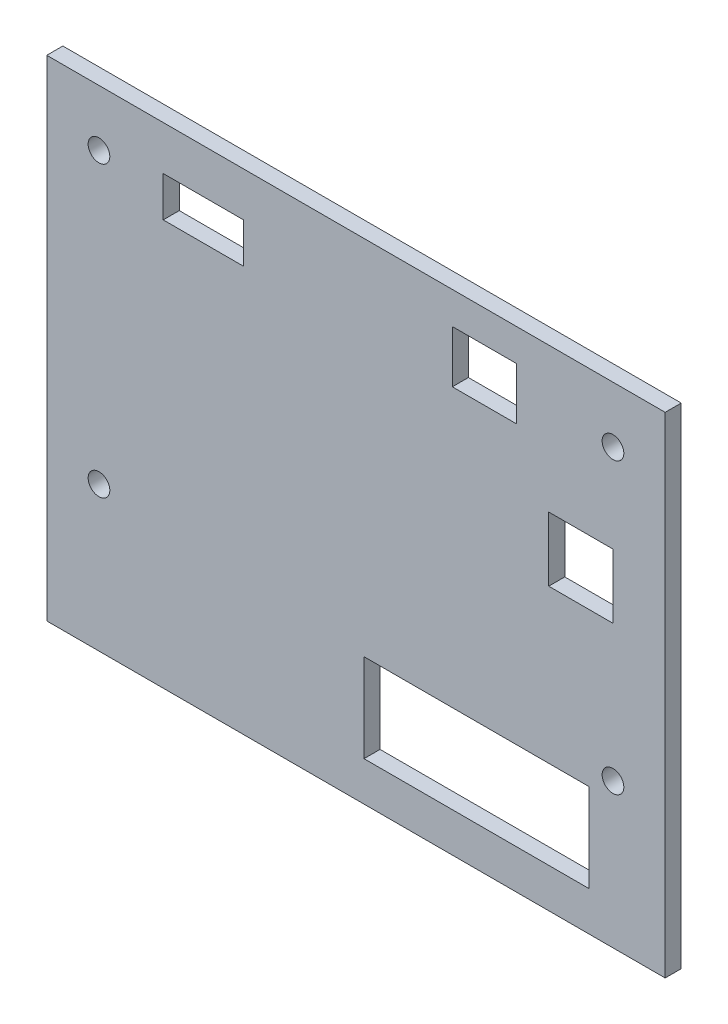
from build123d import *

# Parameters (mm, degrees)
SKETCH_1_W          = 77
SKETCH_1_H          = 61
EXTRUDE_1_DEPTH     = 2
SKETCH_2_W          = 28
SKETCH_2_H          = 11
CUT_EXTRUDE_1_DEPTH = 99.254770877
SKETCH_3_W          = 10
SKETCH_3_H          = 5
SKETCH_3_W_2        = 8
SKETCH_3_H_2        = 6.5
SKETCH_3_H_3        = 8
CUT_EXTRUDE_2_DEPTH = 99.254770877
SKETCH_4_R          = 1.35
CUT_EXTRUDE_3_DEPTH = 99.254770877


with BuildPart() as part:
    # 草图1 → 凸台-拉伸1 (new body)
    with BuildSketch(Plane.XY):
        with Locations((38.5, 30.5)):
            Rectangle(SKETCH_1_W, SKETCH_1_H)
    extrude(amount=EXTRUDE_1_DEPTH)

    # 草图2 → 切除-拉伸1 (cut, through all)
    with BuildSketch(Plane.XY):
        with Locations((53.5, 10.4)):
            Rectangle(SKETCH_2_W, SKETCH_2_H)
    extrude(amount=CUT_EXTRUDE_1_DEPTH, mode=Mode.SUBTRACT)

    # 草图3 → 切除-拉伸2 (cut, through all)
    with BuildSketch(Plane.XY):
        with Locations((19.5, 53)):
            Rectangle(SKETCH_3_W, SKETCH_3_H)
        with Locations((54.5, 53.75)):
            Rectangle(SKETCH_3_W_2, SKETCH_3_H_2)
        with Locations((66.5, 39)):
            Rectangle(SKETCH_3_W_2, SKETCH_3_H_3)
    extrude(amount=CUT_EXTRUDE_2_DEPTH, mode=Mode.SUBTRACT)

    # 草图4 → 切除-拉伸3 (cut, through all)
    with BuildSketch(Plane.XY):
        with Locations((6.5, 18)):
            Circle(SKETCH_4_R)
        with Locations((70.5, 18)):
            Circle(SKETCH_4_R)
        with Locations((6.5, 54)):
            Circle(SKETCH_4_R)
        with Locations((70.5, 54)):
            Circle(SKETCH_4_R)
    extrude(amount=CUT_EXTRUDE_3_DEPTH, mode=Mode.SUBTRACT)


solid = part.part
